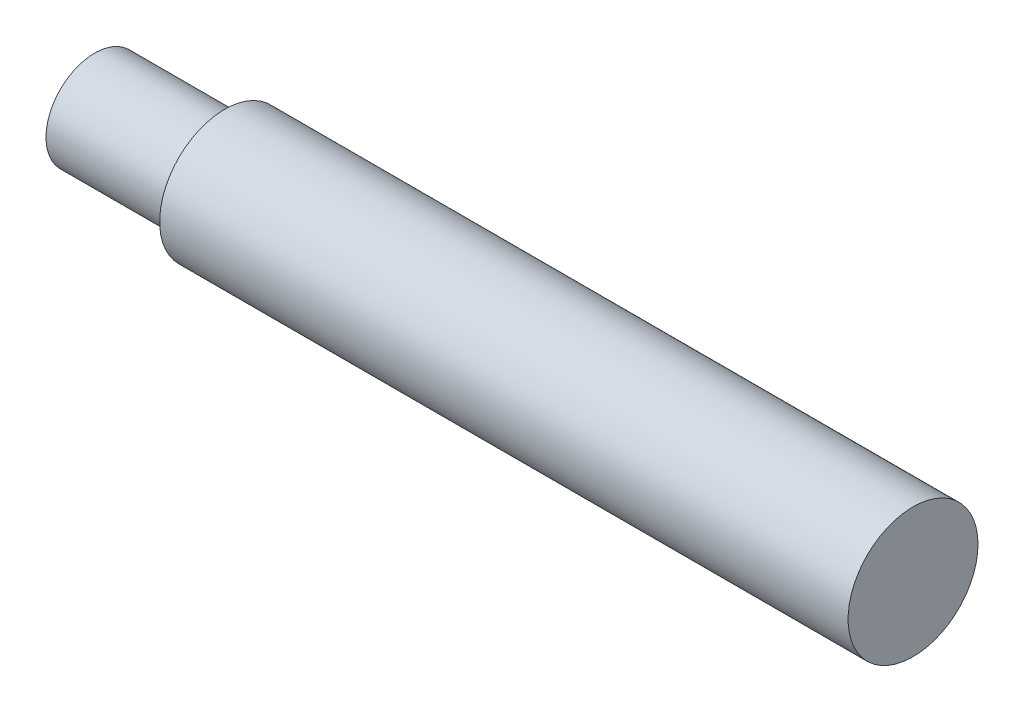
from build123d import *

# Parameters (mm, degrees)
SKETCH2_R           = 10
BOSS_EXTRUDE1_DEPTH = 106
SKETCH3_R           = 7.5
BOSS_EXTRUDE2_DEPTH = 20


with BuildPart() as part:
    # Sketch2 → Boss-Extrude1 (new body)
    with BuildSketch(Plane(origin=(0, 0, 0), x_dir=(0, 0, -1), z_dir=(1, 0, 0))):
        Circle(SKETCH2_R)
    extrude(amount=BOSS_EXTRUDE1_DEPTH)

    # Sketch3 → Boss-Extrude2 (add)
    with BuildSketch(Plane.ZY):
        Circle(SKETCH3_R)
    extrude(amount=BOSS_EXTRUDE2_DEPTH)


solid = part.part
